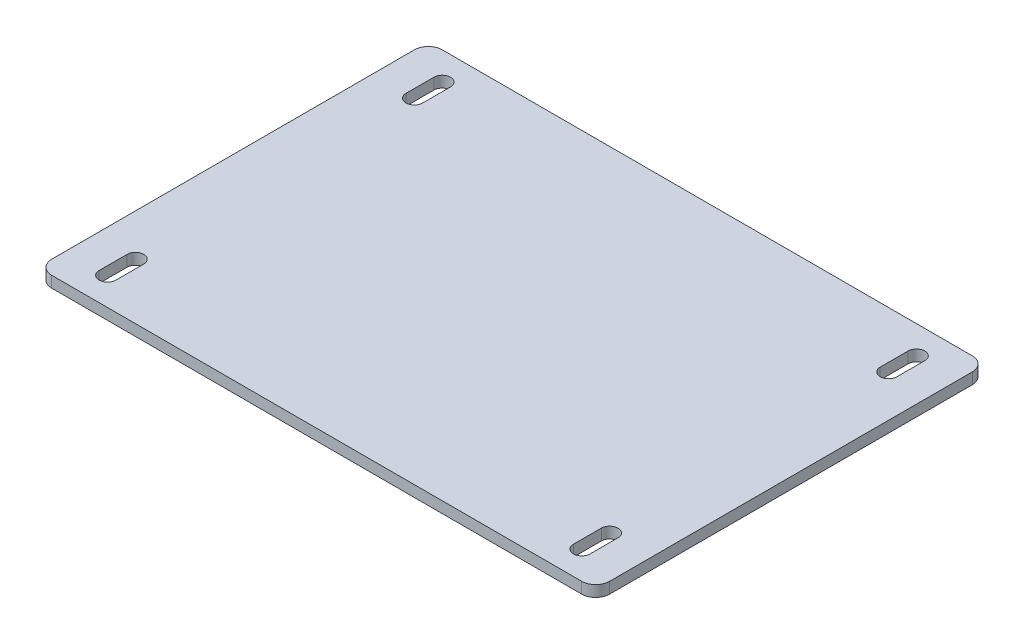
from build123d import *

# Parameters (mm, degrees)
SKETCH1_W           = 200
SKETCH1_H           = 140
BOSS_EXTRUDE1_DEPTH = 2
CUT_EXTRUDE1_DEPTH  = 123.131077126
FILLET1_R           = 5


with BuildPart() as part:
    # Sketch1 → Boss-Extrude1 (new, symmetric)
    with BuildSketch(Plane(origin=(0, 0, 0), x_dir=(1, 0, 0), z_dir=(0, 1, 0))):
        Rectangle(SKETCH1_W, SKETCH1_H)
    extrude(amount=BOSS_EXTRUDE1_DEPTH, both=True)

    # Sketch2 → Cut-Extrude1 (cut, through all)
    with BuildSketch(Plane(origin=(0, 2, 0), x_dir=(1, 0, 0), z_dir=(0, 1, 0))):
        with BuildLine():
            Line((-82, 60), (-82, 50))
            ThreePointArc((-82, 50), (-85, 47), (-88, 50))
            Line((-88, 50), (-88, 60))
            ThreePointArc((-88, 60), (-85, 63), (-82, 60))
        make_face()
        with BuildLine():
            Line((82, 60), (82, 50))
            ThreePointArc((82, 50), (85, 47), (88, 50))
            Line((88, 50), (88, 60))
            ThreePointArc((88, 60), (85, 63), (82, 60))
        make_face()
        with BuildLine():
            Line((82, -60), (82, -50))
            ThreePointArc((82, -50), (85, -47), (88, -50))
            Line((88, -50), (88, -60))
            ThreePointArc((88, -60), (85, -63), (82, -60))
        make_face()
        with BuildLine():
            Line((-82, -60), (-82, -50))
            ThreePointArc((-82, -50), (-85, -47), (-88, -50))
            Line((-88, -50), (-88, -60))
            ThreePointArc((-88, -60), (-85, -63), (-82, -60))
        make_face()
    extrude(amount=-CUT_EXTRUDE1_DEPTH, mode=Mode.SUBTRACT)

    # Fillet1
    fillet1_edges = [part.edges().sort_by_distance(p)[0] for p in [
        (100, 0, -70),
        (-100, 0, -70),
        (-100, 0, 70),
        (100, 0, 70),
    ]]
    fillet(fillet1_edges, radius=FILLET1_R)


solid = part.part
